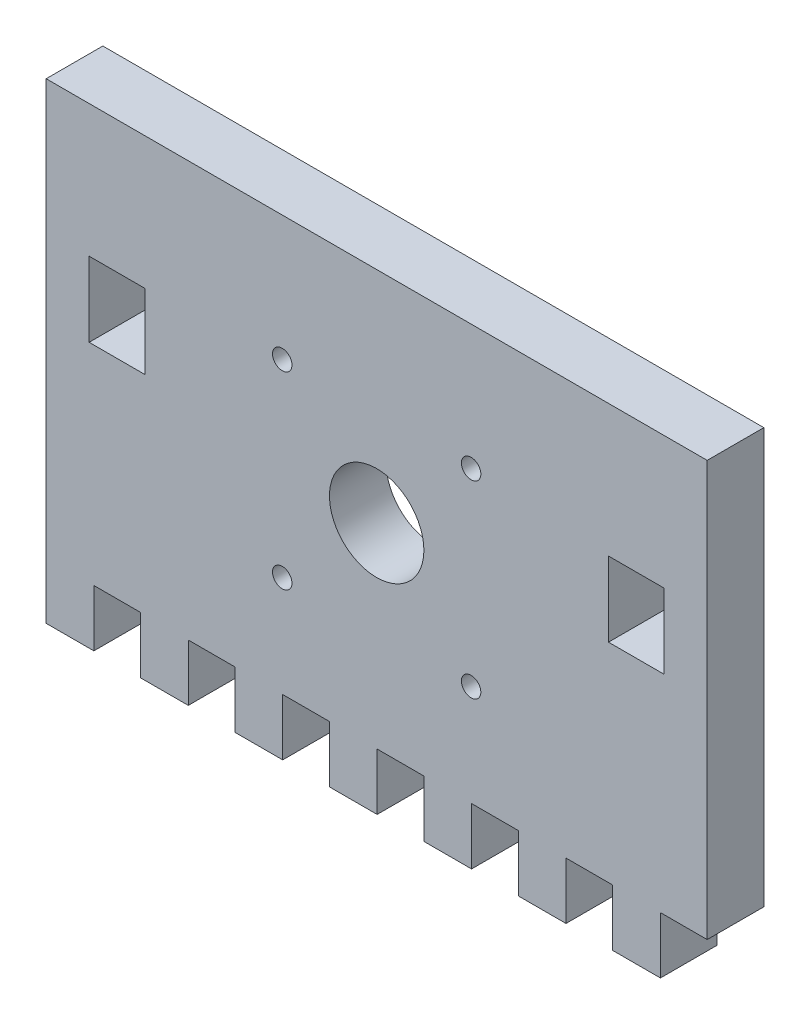
from build123d import *

# Parameters (mm, degrees)
ESQUISSE1_R        = 1.03
ESQUISSE1_R_2      = 5
ESQUISSE1_W        = 5.9
ESQUISSE1_H        = 7.9
BOSS_EXTRU_1_DEPTH = 6


with BuildPart() as part:
    # Esquisse1 → Boss.-Extru.1 (new body)
    with BuildSketch(Plane.XY):
        Polygon((0, 0), (0, 49.95), (70, 49.95), (70, 6), (65.05, 6), (65.05, 0), (60, 0), (60, 6), (55.05, 6), (55.05, 0), (50, 0), (50, 6), (45.05, 6), (45.05, 0), (40, 0), (40, 6), (35.05, 6), (35.05, 0), (30, 0), (30, 6), (25.05, 6), (25.05, 0), (20, 0), (20, 6), (15.05, 6), (15.05, 0), (10, 0), (10, 6), (5.05, 6), (5.05, 0), align=None)
        with Locations((25, 36.7)):
            Circle(ESQUISSE1_R, mode=Mode.SUBTRACT)
        with Locations((45, 36.7)):
            Circle(ESQUISSE1_R, mode=Mode.SUBTRACT)
        with Locations((25, 16.7)):
            Circle(ESQUISSE1_R, mode=Mode.SUBTRACT)
        with Locations((45, 16.7)):
            Circle(ESQUISSE1_R, mode=Mode.SUBTRACT)
        with Locations((35, 26.7)):
            Circle(ESQUISSE1_R_2, mode=Mode.SUBTRACT)
        with Locations((7.5, 32)):
            Rectangle(ESQUISSE1_W, ESQUISSE1_H, mode=Mode.SUBTRACT)
        with Locations((62.5, 32)):
            Rectangle(ESQUISSE1_W, ESQUISSE1_H, mode=Mode.SUBTRACT)
    extrude(amount=BOSS_EXTRU_1_DEPTH)


solid = part.part
